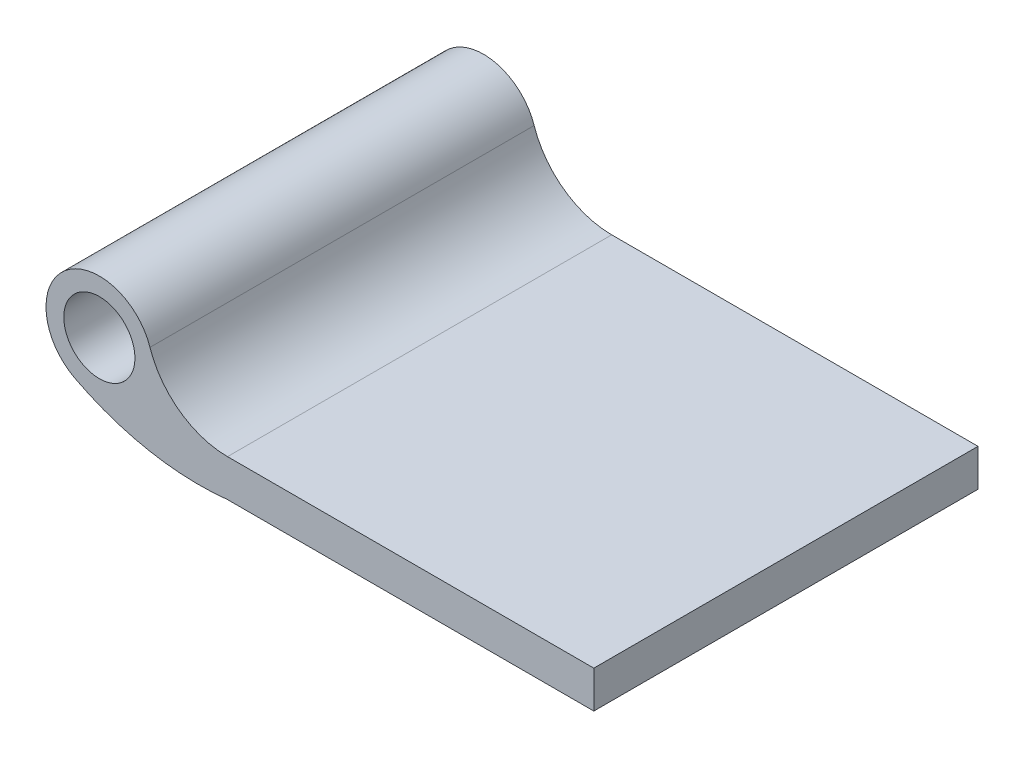
from build123d import *

# Parameters (mm, degrees)
SKETCH1_R           = 10
BOSS_EXTRUDE1_DEPTH = 108


with BuildPart() as part:
    # Sketch1 → Boss-Extrude1 (new body)
    with BuildSketch(Plane.XY):
        with BuildLine():
            ThreePointArc((-6.914894743, -13.311056709), (13.958524045, -20.528091864), (36.026336114, -21.420772553))
            Line((36.026336114, -21.420772553), (139, -21.420772553))
            Line((139, -21.420772553), (139, -10.962803276))
            Line((139, -10.962803276), (36.026336114, -10.962803276))
            ThreePointArc((36.026336114, -10.962803276), (22.592809035, -6.626630029), (14.229640926, 4.745241735))
            ThreePointArc((14.229640926, 4.745241735), (-9.740834476, 11.406846352), (-6.914894743, -13.311056709))
        make_face()
        Circle(SKETCH1_R, mode=Mode.SUBTRACT)
    extrude(amount=BOSS_EXTRUDE1_DEPTH)


solid = part.part
